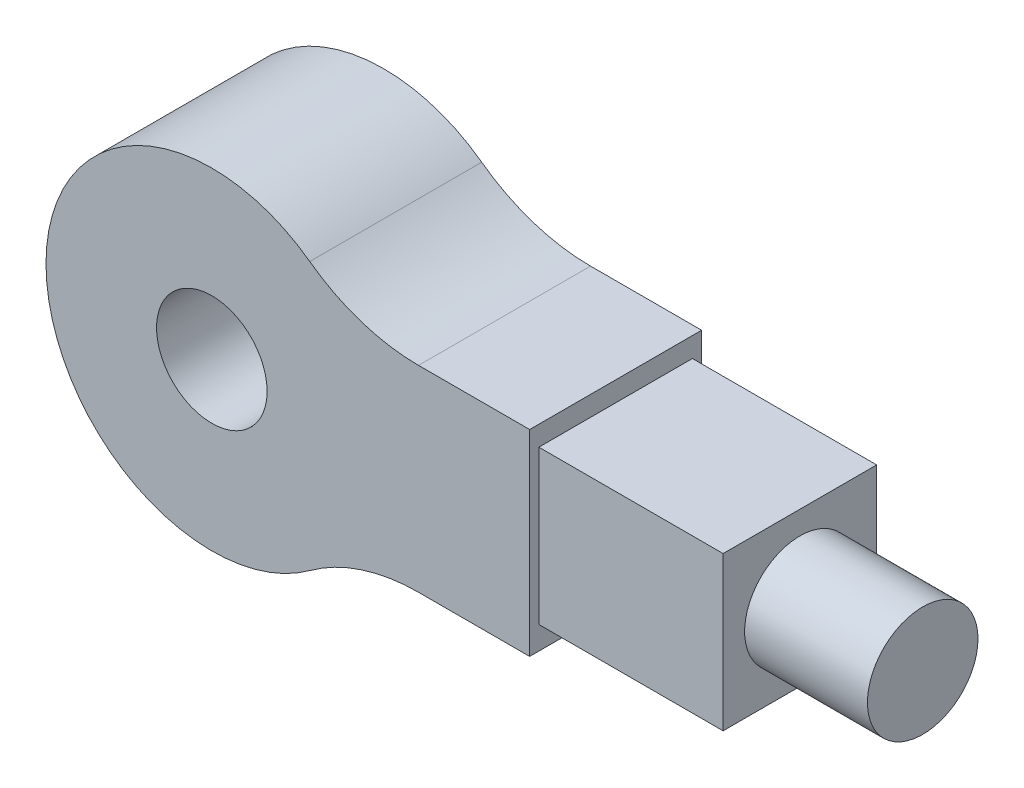
from build123d import *

# Parameters (mm, degrees)
SKETCH5_R           = 9
BOSS_EXTRUDE7_DEPTH = 28
SKETCH6_OUTSIDE_W   = 58.478
SKETCH6_OUTSIDE_H   = 84.478
SKETCH6_OUTSIDE_R   = 9
CUT_EXTRUDE1_DEPTH  = 20
SKETCH7_OUTSIDE_W   = 58.478
SKETCH7_OUTSIDE_H   = 84.478
SKETCH7_OUTSIDE_W_2 = 25
SKETCH7_OUTSIDE_H_2 = 25
CUT_EXTRUDE3_DEPTH  = 30


with BuildPart() as part:
    # Sketch5 → Boss-Extrude7 (new body)
    with BuildSketch(Plane.XY):
        with BuildLine():
            Line((33.660065359, 16), (101.748563171, 16))
            Line((101.748563171, 16), (101.748563171, -16))
            Line((101.748563171, -16), (33.660065359, -16))
            ThreePointArc((33.660065359, -16), (24.341154196, -17.484076471), (15.944241486, -21.789473684))
            ThreePointArc((15.944241486, -21.789473684), (-27, 0), (15.944241486, 21.789473684))
            ThreePointArc((15.944241486, 21.789473684), (24.341154196, 17.484076471), (33.660065359, 16))
        make_face()
        Circle(SKETCH5_R, mode=Mode.SUBTRACT)
    extrude(amount=BOSS_EXTRUDE7_DEPTH)

    # Sketch6 outside → Cut-Extrude1 (cut)
    with BuildSketch(Plane(origin=(101.748563171, 0, 0), x_dir=(0, 0, -1), z_dir=(1, 0, 0))):
        with Locations((-14, 0)):
            Rectangle(SKETCH6_OUTSIDE_W, SKETCH6_OUTSIDE_H)
        with Locations((-14, 0)):
            Circle(SKETCH6_OUTSIDE_R, mode=Mode.SUBTRACT)
    extrude(amount=-CUT_EXTRUDE1_DEPTH, mode=Mode.SUBTRACT)

    # Sketch7 outside → Cut-Extrude3 (cut)
    with BuildSketch(Plane(origin=(81.748563171, 0, 0), x_dir=(0, 0, -1), z_dir=(1, 0, 0))):
        with Locations((-14, 0)):
            Rectangle(SKETCH7_OUTSIDE_W, SKETCH7_OUTSIDE_H)
        with Locations((-14, 0.259981409)):
            Rectangle(SKETCH7_OUTSIDE_W_2, SKETCH7_OUTSIDE_H_2, mode=Mode.SUBTRACT)
    extrude(amount=-CUT_EXTRUDE3_DEPTH, mode=Mode.SUBTRACT)


solid = part.part
